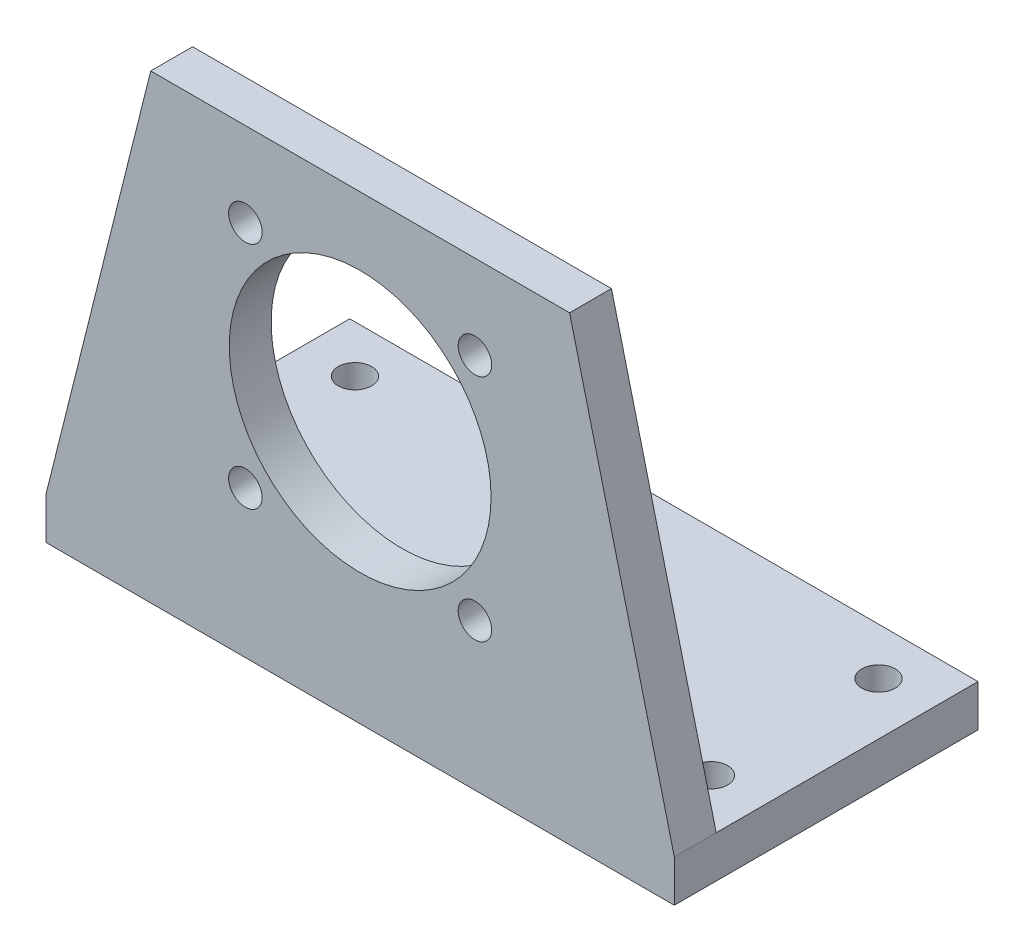
from build123d import *

# Parameters (mm, degrees)
SKETCH_2_R          = 1.6
SKETCH_2_R_2        = 12.5
SKETCH_2_W          = 60
SKETCH_2_H          = 4
EXTRUDE_1_DEPTH     = 4
SKETCH_3_W          = 60
SKETCH_3_H          = 4
EXTRUDE_2_DEPTH     = 25
SKETCH_4_R          = 1.6
CUT_EXTRUDE_1_DEPTH = 25


with BuildPart() as part:
    # 草图2 → 凸台-拉伸1 (new body)
    # profile 1 of 2: a face of its own
    with BuildSketch(Plane.XY):
        Polygon((23.211946481, 19), (-16.788053519, 19), (-26.788053519, -21), (33.211946481, -21), align=None)
        with Locations((14.172101589, -10.960155108)):
            Circle(SKETCH_2_R, mode=Mode.SUBTRACT)
        with Locations((-7.748208627, -10.960155108)):
            Circle(SKETCH_2_R, mode=Mode.SUBTRACT)
        with Locations((-7.748208627, 10.960155108)):
            Circle(SKETCH_2_R, mode=Mode.SUBTRACT)
        with Locations((3.211946481, 0)):
            Circle(SKETCH_2_R_2, mode=Mode.SUBTRACT)
        with Locations((14.172101589, 10.960155108)):
            Circle(SKETCH_2_R, mode=Mode.SUBTRACT)
    # profile 2 of 2: a face of its own
    with BuildSketch(Plane.XY):
        with Locations((3.211946481, -23)):
            Rectangle(SKETCH_2_W, SKETCH_2_H)
    extrude(amount=EXTRUDE_1_DEPTH)

    # 草图3 → 凸台-拉伸2 (add)
    with BuildSketch(Plane(origin=(0, 0, 0), x_dir=(-1, 0, 0), z_dir=(0, 0, -1))):
        with Locations((-3.211946481, -23)):
            Rectangle(SKETCH_3_W, SKETCH_3_H)
    extrude(amount=EXTRUDE_2_DEPTH)

    # 草图4 → 切除-拉伸1 (cut)
    with BuildSketch(Plane.XZ.offset(25)):
        with Locations(Location((-21.788053519, -4.5, 0), (0, 0, 270))):
            Circle(SKETCH_4_R)
        with Locations(Location((28.211946481, -4.5, 0), (0, 0, 270))):
            Circle(SKETCH_4_R)
        with Locations(Location((28.211946481, -20.5, 0), (0, 0, 270))):
            Circle(SKETCH_4_R)
        with Locations(Location((-21.788053519, -20.5, 0), (0, 0, 270))):
            Circle(SKETCH_4_R)
    extrude(amount=-CUT_EXTRUDE_1_DEPTH, mode=Mode.SUBTRACT)


solid = part.part
